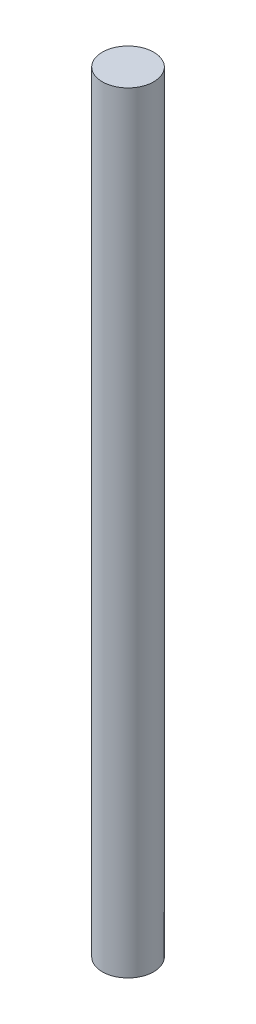
from build123d import *

# Parameters (mm, degrees)
SKETCH2_R           = 6
BOSS_EXTRUDE1_DEPTH = 90


with BuildPart() as part:
    # Sketch2 → Boss-Extrude1 (new, symmetric)
    with BuildSketch(Plane(origin=(0, 0, 0), x_dir=(1, 0, 0), z_dir=(0, 1, 0))):
        with Locations(Location((0, 0, 0), (0, 0, 90))):
            Circle(SKETCH2_R)
    extrude(amount=BOSS_EXTRUDE1_DEPTH, both=True)


solid = part.part
